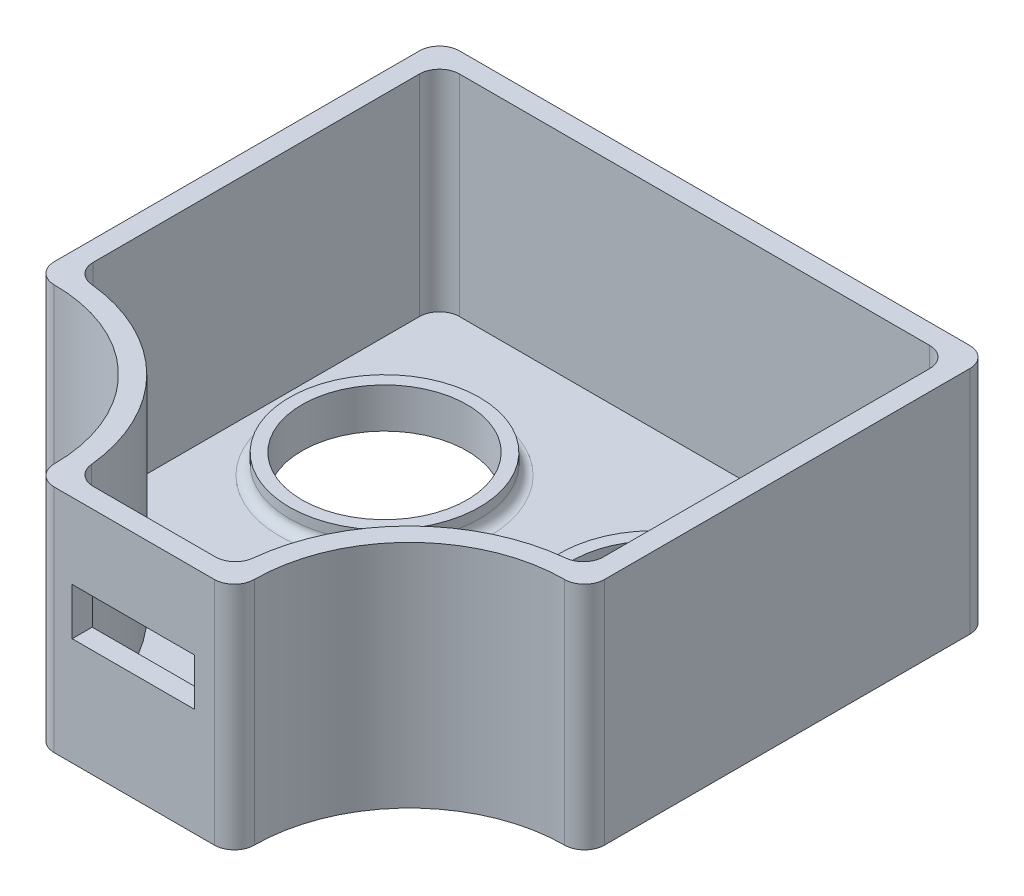
from build123d import *

# Parameters (mm, degrees)
SALIENTE_EXTRUIR1_DEPTH = 23
CROQUIS1_4_R            = 9.5
SALIENTE_EXTRUIR2_DEPTH = 2
CROQUIS1_6_R            = 9.5
CROQUIS1_6_R_2          = 8.25
SALIENTE_EXTRUIR3_DEPTH = 4
CROQUIS2_W              = 12.2
CROQUIS2_H              = 4.7
CORTAR_EXTRUIR4_DEPTH   = 4
REDONDEO1_R             = 1
REDONDEO2_R             = 1


with BuildPart() as part:
    # Croquis1 → Saliente-Extruir1 (new body)
    with BuildSketch(Plane(origin=(0, 0, 0), x_dir=(1, 0, 0), z_dir=(0, 1, 0))):
        with BuildLine():
            Line((16.889220689, 19.491025662), (-34.110779311, 19.491025662))
            ThreePointArc((-34.110779311, 19.491025662), (-35.524992874, 18.905239224), (-36.110779311, 17.491025662))
            Line((-36.110779311, 17.491025662), (-36.110779311, -19.008974338))
            ThreePointArc((-36.110779311, -19.008974338), (-35.524992874, -20.423187901), (-34.110779311, -21.008974338))
            ThreePointArc((-34.110779311, -21.008974338), (-23.150624203, -25.54881923), (-18.610779311, -36.508974338))
            ThreePointArc((-18.610779311, -36.508974338), (-18.024992874, -37.923187901), (-16.610779311, -38.508974338))
            Line((-16.610779311, -38.508974338), (-0.610779311, -38.508974338))
            ThreePointArc((-0.610779311, -38.508974338), (0.803434251, -37.923187901), (1.389220689, -36.508974338))
            ThreePointArc((1.389220689, -36.508974338), (5.92906558, -25.54881923), (16.889220689, -21.008974338))
            ThreePointArc((16.889220689, -21.008974338), (18.303434251, -20.423187901), (18.889220689, -19.008974338))
            Line((18.889220689, -19.008974338), (18.889220689, 17.491025662))
            ThreePointArc((18.889220689, 17.491025662), (18.303434251, 18.905239224), (16.889220689, 19.491025662))
        make_face()
        with BuildLine():
            ThreePointArc((-34.110779311, 15.491025662), (-33.524992874, 16.905239224), (-32.110779311, 17.491025662))
            Line((-32.110779311, 17.491025662), (14.889220689, 17.491025662))
            ThreePointArc((14.889220689, 17.491025662), (16.303434251, 16.905239224), (16.889220689, 15.491025662))
            Line((16.889220689, 15.491025662), (16.889220689, -17.111809597))
            ThreePointArc((16.889220689, -17.111809597), (16.374188097, -18.451537851), (15.094348894, -19.101262391))
            ThreePointArc((15.094348894, -19.101262391), (4.514852018, -24.134605668), (-0.518491259, -34.714102544))
            ThreePointArc((-0.518491259, -34.714102544), (-1.168215799, -35.993941747), (-2.507944053, -36.508974338))
            Line((-2.507944053, -36.508974338), (-14.71361457, -36.508974338))
            ThreePointArc((-14.71361457, -36.508974338), (-16.053342824, -35.993941747), (-16.703067364, -34.714102544))
            ThreePointArc((-16.703067364, -34.714102544), (-21.736410641, -24.134605668), (-32.315907517, -19.101262391))
            ThreePointArc((-32.315907517, -19.101262391), (-33.59574672, -18.451537851), (-34.110779311, -17.111809597))
            Line((-34.110779311, -17.111809597), (-34.110779311, 15.491025662))
        make_face(mode=Mode.SUBTRACT)
    extrude(amount=SALIENTE_EXTRUIR1_DEPTH)

    # Croquis1<4> → Saliente-Extruir2 (add)
    with BuildSketch(Plane(origin=(0, 0, 0), x_dir=(1, 0, 0), z_dir=(0, 1, 0))):
        with BuildLine():
            Line((14.889220689, 17.491025662), (-32.110779311, 17.491025662))
            ThreePointArc((-32.110779311, 17.491025662), (-33.524992874, 16.905239224), (-34.110779311, 15.491025662))
            Line((-34.110779311, 15.491025662), (-34.110779311, -17.111809597))
            ThreePointArc((-34.110779311, -17.111809597), (-33.59574672, -18.451537851), (-32.315907517, -19.101262391))
            ThreePointArc((-32.315907517, -19.101262391), (-21.736410641, -24.134605668), (-16.703067364, -34.714102544))
            ThreePointArc((-16.703067364, -34.714102544), (-16.053342824, -35.993941747), (-14.71361457, -36.508974338))
            Line((-14.71361457, -36.508974338), (-2.507944053, -36.508974338))
            ThreePointArc((-2.507944053, -36.508974338), (-1.168215799, -35.993941747), (-0.518491259, -34.714102544))
            ThreePointArc((-0.518491259, -34.714102544), (4.514852018, -24.134605668), (15.094348894, -19.101262391))
            ThreePointArc((15.094348894, -19.101262391), (16.374188097, -18.451537851), (16.889220689, -17.111809597))
            Line((16.889220689, -17.111809597), (16.889220689, 15.491025662))
            ThreePointArc((16.889220689, 15.491025662), (16.303434251, 16.905239224), (14.889220689, 17.491025662))
        make_face()
        with Locations((-22.110779311, 0)):
            Circle(CROQUIS1_4_R, mode=Mode.SUBTRACT)
        with Locations((4.889220689, 0)):
            Circle(CROQUIS1_4_R, mode=Mode.SUBTRACT)
    extrude(amount=SALIENTE_EXTRUIR2_DEPTH)

    # Croquis1<6> → Saliente-Extruir3 (add)
    # profile 1 of 2: a face of its own
    with BuildSketch(Plane(origin=(0, 0, 0), x_dir=(1, 0, 0), z_dir=(0, 1, 0))):
        with Locations((-22.110779311, 0)):
            Circle(CROQUIS1_6_R)
        with Locations((-22.110779311, 0)):
            Circle(CROQUIS1_6_R_2, mode=Mode.SUBTRACT)
    # profile 2 of 2: a face of its own
    with BuildSketch(Plane(origin=(0, 0, 0), x_dir=(1, 0, 0), z_dir=(0, 1, 0))):
        with Locations((4.889220689, 0)):
            Circle(CROQUIS1_6_R)
        with Locations((4.889220689, 0)):
            Circle(CROQUIS1_6_R_2, mode=Mode.SUBTRACT)
    extrude(amount=SALIENTE_EXTRUIR3_DEPTH)

    # Croquis2 → Cortar-Extruir4 (cut)
    with BuildSketch(Plane.XY.offset(38.508974338)):
        with Locations((-8.713971977, 13.114927271)):
            Rectangle(CROQUIS2_W, CROQUIS2_H)
    extrude(amount=-CORTAR_EXTRUIR4_DEPTH, mode=Mode.SUBTRACT)

    # Redondeo1
    redondeo1_edges = [part.edges().sort_by_distance(p)[0] for p in [
        (-31.610779311, 2, 0),
    ]]
    fillet(redondeo1_edges, radius=REDONDEO1_R)

    # Redondeo2
    redondeo2_edges = [part.edges().sort_by_distance(p)[0] for p in [
        (-4.610779311, 2, 0),
    ]]
    fillet(redondeo2_edges, radius=REDONDEO2_R)


solid = part.part
